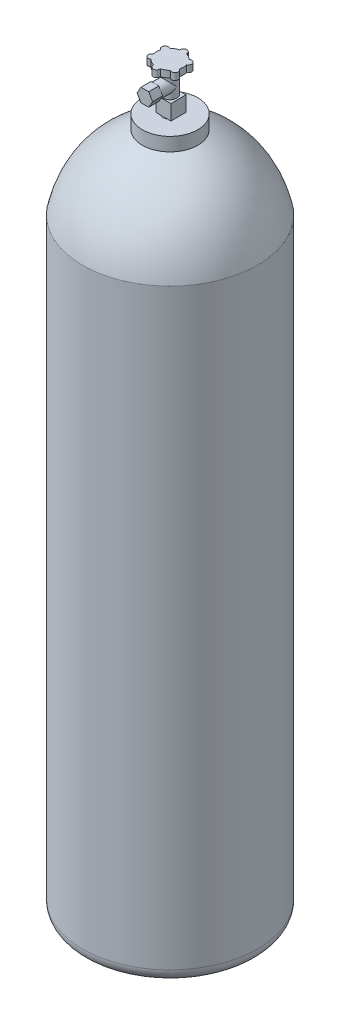
from build123d import *

# Parameters (mm, degrees)
BOSS_EXTRUDE1_DEPTH = 12.7
BOSS_EXTRUDE2_START = -12.7
SKETCH3_W           = 28.575
SKETCH3_H           = 28.575
BOSS_EXTRUDE2_DEPTH = 28.575
SKETCH4_R           = 12.7
BOSS_EXTRUDE3_DEPTH = 28.575
BOSS_EXTRUDE4_DEPTH = 19.05
FILLET1_R           = 25.4


with BuildPart() as part:
    # Sketch1 → Revolve1 (revolve)
    with BuildSketch(Plane.XY, mode=Mode.PRIVATE) as revolve1_sk:
        with BuildLine():
            Line((0, 0), (165.1, 0))
            Line((165.1, 0), (165.1, 1143))
            add(Edge.make_bspline(
                [(165.1, 1143), (143.698147325, 1240.08378947), (52.321616657, 1282.7)],
                knots=[0, 0, 0, 1, 1, 1], degree=2))
            Line((52.321616657, 1282.7), (52.321616657, 1308.1))
            Line((52.321616657, 1308.1), (12.7, 1308.1))
            Line((12.7, 1308.1), (12.7, 1384.3))
            Line((12.7, 1384.3), (25.4, 1384.3))
            Line((25.4, 1384.3), (25.4, 1397))
            Line((25.4, 1397), (0, 1397))
            Line((0, 1397), (0, 0))
        make_face()
    revolve(revolve1_sk.sketch.rotate(Axis((0, 0, 0), (0, 1, 0)), 90), axis=Axis((0, 0, 0), (0, 1, 0)))

    # Sketch2 → Boss-Extrude1 (add)
    with BuildSketch(Plane(origin=(0, 1397, 0), x_dir=(1, 0, 0), z_dir=(0, 1, 0))):
        with BuildLine():
            ThreePointArc((-18.159539937, -17.759254187), (-12.7, -21.997045256), (-6.300195309, -24.60625))
            ThreePointArc((-6.300195309, -24.60625), (0, -31.75), (6.300195309, -24.60625))
            ThreePointArc((6.300195309, -24.60625), (12.7, -21.997045256), (18.159539937, -17.759254187))
            ThreePointArc((18.159539937, -17.759254187), (27.49630657, -15.875), (24.459735247, -6.846995813))
            ThreePointArc((24.459735247, -6.846995813), (25.4, 0), (24.459735247, 6.846995813))
            ThreePointArc((24.459735247, 6.846995813), (27.49630657, 15.875), (18.159539937, 17.759254187))
            ThreePointArc((18.159539937, 17.759254187), (12.7, 21.997045256), (6.300195309, 24.60625))
            ThreePointArc((6.300195309, 24.60625), (0, 31.75), (-6.300195309, 24.60625))
            ThreePointArc((-6.300195309, 24.60625), (-12.7, 21.997045256), (-18.159539937, 17.759254187))
            ThreePointArc((-18.159539937, 17.759254187), (-27.49630657, 15.875), (-24.459735247, 6.846995813))
            ThreePointArc((-24.459735247, 6.846995813), (-25.4, 0), (-24.459735247, -6.846995813))
            ThreePointArc((-24.459735247, -6.846995813), (-27.49630657, -15.875), (-18.159539937, -17.759254187))
        make_face()
    extrude(amount=-BOSS_EXTRUDE1_DEPTH)

    # Sketch3 → Boss-Extrude2 (add)
    with BuildSketch(Plane(origin=(0, 0, 0), x_dir=(0, 0, -1), z_dir=(1, 0, 0)).offset(BOSS_EXTRUDE2_START)):
        with Locations((0, 1325.5625)):
            Rectangle(SKETCH3_W, SKETCH3_H)
    extrude(amount=BOSS_EXTRUDE2_DEPTH)

    # Sketch4 → Boss-Extrude3 (add)
    with BuildSketch(Plane.XY):
        with Locations((0, 1358.9)):
            Circle(SKETCH4_R)
    extrude(amount=BOSS_EXTRUDE3_DEPTH)

    # Sketch5 → Boss-Extrude4 (add)
    with BuildSketch(Plane.XY.offset(28.575)):
        Polygon((14.664696837, 1358.9), (7.332348419, 1371.6), (-7.332348419, 1371.6), (-14.664696837, 1358.9), (-7.332348419, 1346.2), (7.332348419, 1346.2), align=None)
    extrude(amount=BOSS_EXTRUDE4_DEPTH)

    # Fillet1
    fillet1_edges = [part.edges().sort_by_distance(p)[0] for p in [
        (0, 0, 165.1),
    ]]
    fillet(fillet1_edges, radius=FILLET1_R)


solid = part.part
